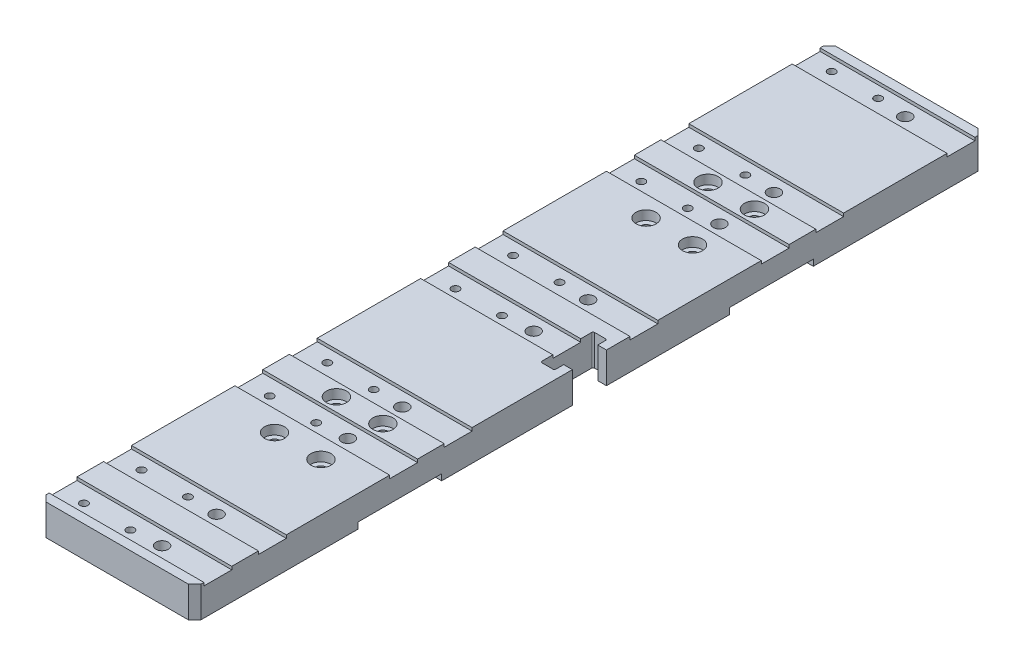
from build123d import *

# Parameters (mm, degrees)
SKETCH_1_W                          = 50
SKETCH_1_H                          = 255
EXTRUDE_1_DEPTH                     = 10
SKETCH_2_W                          = 50
SKETCH_2_H                          = 9
CUT_EXTRUDE_1_DEPTH                 = 1
PATTERN_LINEAR_1_COUNT              = 5
PATTERN_LINEAR_1_PITCH              = 60
HOLE_WIZARD_M3_1_D                  = 3.4
HOLE_WIZARD_M3_1_CBORE_D            = 6.5
HOLE_WIZARD_M3_1_CBORE_DEPTH        = 3
PATTERN_LINEAR_2_COUNT              = 2
PATTERN_LINEAR_2_PITCH              = 15
PATTERN_LINEAR_3_COPY_1_D           = 3.4
PATTERN_LINEAR_3_COPY_1_CBORE_D     = 6.5
PATTERN_LINEAR_3_COPY_1_CBORE_DEPTH = 3
PATTERN_LINEAR_3_COPY_2_D           = 3.4
PATTERN_LINEAR_3_COPY_2_CBORE_D     = 6.5
PATTERN_LINEAR_3_COPY_2_CBORE_DEPTH = 3
PATTERN_LINEAR_4_COUNT              = 2
PATTERN_LINEAR_4_PITCH              = 20
PATTERN_LINEAR_4_COPY_1_D           = 3.4
PATTERN_LINEAR_4_COPY_1_CBORE_D     = 6.5
PATTERN_LINEAR_4_COPY_1_CBORE_DEPTH = 3
PATTERN_LINEAR_4_COPY_2_D           = 3.4
PATTERN_LINEAR_4_COPY_2_CBORE_D     = 6.5
PATTERN_LINEAR_4_COPY_2_CBORE_DEPTH = 3
PATTERN_LINEAR_4_COPY_3_D           = 3.4
PATTERN_LINEAR_4_COPY_3_CBORE_D     = 6.5
PATTERN_LINEAR_4_COPY_3_CBORE_DEPTH = 3
SKETCH_6_W                          = 27
SKETCH_6_H                          = 2
CUT_EXTRUDE_2_DEPTH                 = 138.318061449
PATTERN_LINEAR_5_COUNT              = 2
PATTERN_LINEAR_5_PITCH              = 120
CUT_EXTRUDE_3_DEPTH                 = 131.312125299
CHAMFER_1_SIZE                      = 2
HOLE_WIZARD_M3_1_2_D                = 2.5
SKETCH_10_R                         = 2
CUT_EXTRUDE_4_DEPTH                 = 131.312125299


with BuildPart() as part:
    # 草图1 → 凸台-拉伸1 (new body)
    with BuildSketch(Plane(origin=(0, 0, 0), x_dir=(1, 0, 0), z_dir=(0, 1, 0))):
        Rectangle(SKETCH_1_W, SKETCH_1_H)
    extrude(amount=EXTRUDE_1_DEPTH)

    # 草图2 → 切除-拉伸1 (cut)
    with BuildSketch(Plane(origin=(0, 10, 0), x_dir=(1, 0, 0), z_dir=(0, 1, 0))):
        with Locations((0, -120)):
            Rectangle(SKETCH_2_W, SKETCH_2_H)
        with Locations((0, -102.4)):
            Rectangle(SKETCH_2_W, SKETCH_2_H)
    cut_extrude_1 = extrude(amount=-CUT_EXTRUDE_1_DEPTH, mode=Mode.SUBTRACT)

    # 阵列(线性)1: 切除-拉伸1 ×5
    with Locations(*[(0, 0, -i * PATTERN_LINEAR_1_PITCH) for i in range(1, PATTERN_LINEAR_1_COUNT)]):
        add(cut_extrude_1, mode=Mode.SUBTRACT)

    # Hole Wizard M3 _1 (through all)
    with Locations(Plane(origin=(0, 10, 0), x_dir=(-1, 0, 0), z_dir=(0, 1, 0))):
        with Locations((5.5, 51.2)):
            hole_wizard_m3_1 = CounterBoreHole(HOLE_WIZARD_M3_1_D / 2, HOLE_WIZARD_M3_1_CBORE_D / 2, HOLE_WIZARD_M3_1_CBORE_DEPTH)

    # 阵列(线性)2: Hole Wizard M3 _1 ×2
    with Locations(*[(i * PATTERN_LINEAR_2_PITCH, 0, 0) for i in range(1, PATTERN_LINEAR_2_COUNT)]):
        add(hole_wizard_m3_1, mode=Mode.SUBTRACT)

    # 阵列(线性)3 copy 1 (through all)
    with Locations(Plane(origin=(15, 10, -120), x_dir=(-1, 0, 0), z_dir=(0, 1, 0))):
        with Locations((5.5, 51.2)):
            CounterBoreHole(PATTERN_LINEAR_3_COPY_1_D / 2, PATTERN_LINEAR_3_COPY_1_CBORE_D / 2, PATTERN_LINEAR_3_COPY_1_CBORE_DEPTH)

    # 阵列(线性)3 copy 2 (through all)
    with Locations(Plane(origin=(0, 10, -120), x_dir=(-1, 0, 0), z_dir=(0, 1, 0))):
        with Locations((5.5, 51.2)):
            CounterBoreHole(PATTERN_LINEAR_3_COPY_2_D / 2, PATTERN_LINEAR_3_COPY_2_CBORE_D / 2, PATTERN_LINEAR_3_COPY_2_CBORE_DEPTH)

    # 阵列(线性)4: Hole Wizard M3 _1 ×2
    with Locations(*[(0, 0, i * PATTERN_LINEAR_4_PITCH) for i in range(1, PATTERN_LINEAR_4_COUNT)]):
        add(hole_wizard_m3_1, mode=Mode.SUBTRACT)

    # 阵列(线性)4 copy 1 (through all)
    with Locations(Plane(origin=(15, 10, 20), x_dir=(-1, 0, 0), z_dir=(0, 1, 0))):
        with Locations((5.5, 51.2)):
            CounterBoreHole(PATTERN_LINEAR_4_COPY_1_D / 2, PATTERN_LINEAR_4_COPY_1_CBORE_D / 2, PATTERN_LINEAR_4_COPY_1_CBORE_DEPTH)

    # 阵列(线性)4 copy 2 (through all)
    with Locations(Plane(origin=(15, 10, -100), x_dir=(-1, 0, 0), z_dir=(0, 1, 0))):
        with Locations((5.5, 51.2)):
            CounterBoreHole(PATTERN_LINEAR_4_COPY_2_D / 2, PATTERN_LINEAR_4_COPY_2_CBORE_D / 2, PATTERN_LINEAR_4_COPY_2_CBORE_DEPTH)

    # 阵列(线性)4 copy 3 (through all)
    with Locations(Plane(origin=(0, 10, -100), x_dir=(-1, 0, 0), z_dir=(0, 1, 0))):
        with Locations((5.5, 51.2)):
            CounterBoreHole(PATTERN_LINEAR_4_COPY_3_D / 2, PATTERN_LINEAR_4_COPY_3_CBORE_D / 2, PATTERN_LINEAR_4_COPY_3_CBORE_DEPTH)

    # 草图6 → 切除-拉伸2 (cut, through all)
    with BuildSketch(Plane(origin=(25, 0, 0), x_dir=(0, 0, -1), z_dir=(1, 0, 0))):
        with Locations((-61.2, 1)):
            Rectangle(SKETCH_6_W, SKETCH_6_H)
    cut_extrude_2 = extrude(amount=-CUT_EXTRUDE_2_DEPTH, mode=Mode.SUBTRACT)

    # 阵列(线性)5: 切除-拉伸2 ×2
    with Locations(*[(0, 0, -i * PATTERN_LINEAR_5_PITCH) for i in range(1, PATTERN_LINEAR_5_COUNT)]):
        add(cut_extrude_2, mode=Mode.SUBTRACT)

    # 草图7 → 切除-拉伸3 (cut, through all)
    with BuildSketch(Plane(origin=(0, 10, 0), x_dir=(1, 0, 0), z_dir=(0, 1, 0))):
        with BuildLine():
            Line((25, -5.5), (22.2, -5.5))
            Line((22.2, -5.5), (22.2, -8))
            ThreePointArc((22.2, -8), (22.053553391, -8.353553391), (21.7, -8.5))
            Line((21.7, -8.5), (18.2, -8.5))
            ThreePointArc((18.2, -8.5), (17.846446609, -8.353553391), (17.7, -8))
            Line((17.7, -8), (17.7, 8))
            ThreePointArc((17.7, 8), (17.846446609, 8.353553391), (18.2, 8.5))
            Line((18.2, 8.5), (21.7, 8.5))
            ThreePointArc((21.7, 8.5), (22.053553391, 8.353553391), (22.2, 8))
            Line((22.2, 8), (22.2, 5.5))
            Line((22.2, 5.5), (25, 5.5))
            Line((25, 5.5), (25, -5.5))
        make_face()
    extrude(amount=-CUT_EXTRUDE_3_DEPTH, mode=Mode.SUBTRACT)

    # 倒角1
    chamfer_1_edges = [part.edges().sort_by_distance(p)[0] for p in [
        (-25, 5, -127.5),
        (25, 5, -127.5),
        (-25, 5, 127.5),
        (25, 5, 127.5),
    ]]
    chamfer(chamfer_1_edges, length=CHAMFER_1_SIZE)

    # Hole Wizard M3 _1 2 (through all)
    with Locations(Plane(origin=(0, 10, 0), x_dir=(-1, 0, 0), z_dir=(0, 1, 0))):
        with Locations((17.5, 120.75), (17.5, 102.15), (2.5, 120.75), (2.5, 102.15), (17.5, 60.75), (2.5, 60.75), (2.5, 42.15), (17.5, 42.15), (17.5, 0.75), (2.5, 0.75), (2.5, -17.85), (17.5, -17.85), (17.5, -59.25), (2.5, -59.25), (2.5, -77.85), (17.5, -77.85), (17.5, -120.75), (2.5, -120.75)):
            Hole(HOLE_WIZARD_M3_1_2_D / 2)

    # 草图10 → 切除-拉伸4 (cut, through all)
    with BuildSketch(Plane(origin=(0, 10, 0), x_dir=(1, 0, 0), z_dir=(0, 1, 0))):
        with Locations((7, 120)):
            Circle(SKETCH_10_R)
        with Locations((7, 77.6)):
            Circle(SKETCH_10_R)
        with Locations((7, 60)):
            Circle(SKETCH_10_R)
        with Locations((7, 17.6)):
            Circle(SKETCH_10_R)
        with Locations((7, 0)):
            Circle(SKETCH_10_R)
        with Locations((7, -42.4)):
            Circle(SKETCH_10_R)
        with Locations((7, -60)):
            Circle(SKETCH_10_R)
        with Locations((7, -102.4)):
            Circle(SKETCH_10_R)
        with Locations((7, -120)):
            Circle(SKETCH_10_R)
    extrude(amount=-CUT_EXTRUDE_4_DEPTH, mode=Mode.SUBTRACT)


solid = part.part
